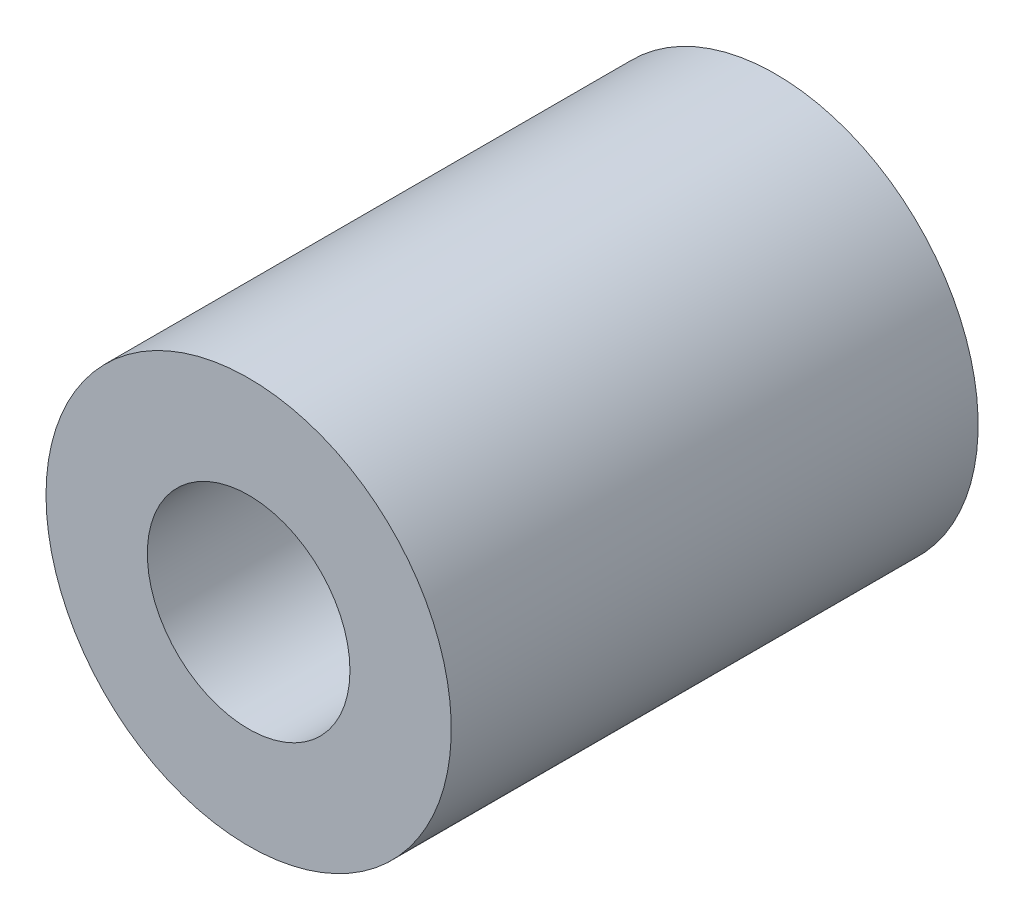
from build123d import *

# Parameters (mm, degrees)
SKETCH1_R           = 10
BOSS_EXTRUDE1_DEPTH = 26
SKETCH2_R           = 5
CUT_EXTRUDE1_DEPTH  = 8
SKETCH3_R           = 2
CUT_EXTRUDE2_DEPTH  = 8


with BuildPart() as part:
    # Sketch1 → Boss-Extrude1 (new body)
    with BuildSketch(Plane.XY):
        with Locations(Location((0, 0, 0), (0, 0, 180))):
            Circle(SKETCH1_R)
    extrude(amount=BOSS_EXTRUDE1_DEPTH)

    # Sketch2 → Cut-Extrude1 (cut)
    with BuildSketch(Plane.XY.offset(26)):
        Circle(SKETCH2_R)
    extrude(amount=-CUT_EXTRUDE1_DEPTH, mode=Mode.SUBTRACT)

    # Sketch3 → Cut-Extrude2 (cut)
    with BuildSketch(Plane(origin=(0, 0, 0), x_dir=(-1, 0, 0), z_dir=(0, 0, -1))):
        Circle(SKETCH3_R)
    extrude(amount=-CUT_EXTRUDE2_DEPTH, mode=Mode.SUBTRACT)


solid = part.part
